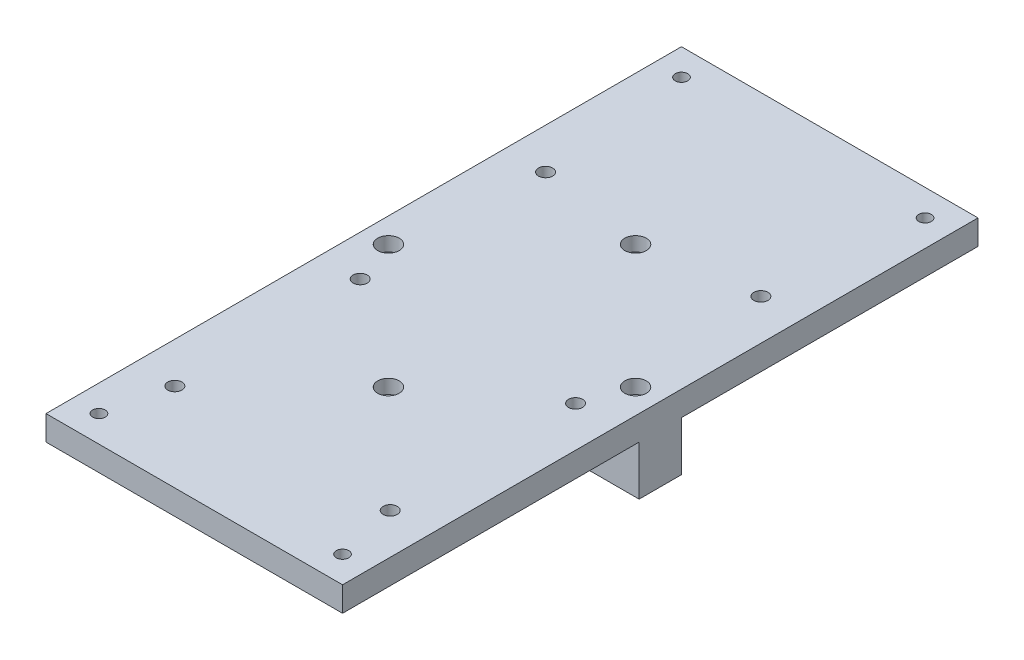
from build123d import *

# Parameters (mm, degrees)
SKETCH1_W           = 84
SKETCH1_H           = 180
BOSS_EXTRUDE1_DEPTH = 7
SKETCH2_R           = 1.775
CUT_EXTRUDE1_DEPTH  = 103.960355362
SKETCH3_R           = 3.05
CUT_EXTRUDE2_DEPTH  = 4
SKETCH5_W           = 12
SKETCH5_H           = 12
SKETCH5_W_2         = 14
BOSS_EXTRUDE2_DEPTH = 14
SKETCH6_R           = 1.775
CUT_EXTRUDE3_DEPTH  = 105.846720389
SKETCH7_R           = 2
CUT_EXTRUDE4_DEPTH  = 105.846720389
SKETCH8_R           = 1.775
CUT_EXTRUDE5_DEPTH  = 105.846720389


with BuildPart() as part:
    # Sketch1 → Boss-Extrude1 (new body)
    with BuildSketch(Plane(origin=(0, 0, 0), x_dir=(1, 0, 0), z_dir=(0, 1, 0))):
        with Locations((-5.498242658, 1.081017345)):
            Rectangle(SKETCH1_W, SKETCH1_H)
    extrude(amount=BOSS_EXTRUDE1_DEPTH)

    # Sketch2 → Cut-Extrude1 (cut, through all)
    with BuildSketch(Plane(origin=(0, 7, 0), x_dir=(1, 0, 0), z_dir=(0, 1, 0))):
        with Locations(Location((-40.498242658, 1.081017345, 0), (0, 0, 270))):
            Circle(SKETCH2_R)
        with Locations(Location((-5.498242658, -33.918982655, 0), (0, 0, 270))):
            Circle(SKETCH2_R)
        with Locations(Location((29.501757342, 1.081017345, 0), (0, 0, 270))):
            Circle(SKETCH2_R)
        with Locations(Location((-5.498242658, 36.081017345, 0), (0, 0, 270))):
            Circle(SKETCH2_R)
    extrude(amount=-CUT_EXTRUDE1_DEPTH, mode=Mode.SUBTRACT)

    # Sketch3 → Cut-Extrude2 (cut)
    with BuildSketch(Plane(origin=(0, 7, 0), x_dir=(1, 0, 0), z_dir=(0, 1, 0))):
        with Locations(Location((-40.498242658, 1.081017345, 0), (0, 0, 270))):
            Circle(SKETCH3_R)
        with Locations(Location((-5.498242658, -33.918982655, 0), (0, 0, 270))):
            Circle(SKETCH3_R)
        with Locations(Location((-5.498242658, 36.081017345, 0), (0, 0, 270))):
            Circle(SKETCH3_R)
        with Locations(Location((29.501757342, 1.081017345, 0), (0, 0, 270))):
            Circle(SKETCH3_R)
    extrude(amount=-CUT_EXTRUDE2_DEPTH, mode=Mode.SUBTRACT)

    # Sketch5 → Boss-Extrude2 (add)
    with BuildSketch(Plane(origin=(0, 0, 0), x_dir=(-1, 0, 0), z_dir=(0, -1, 0))):
        with Locations((5.498242658, -33.918982655)):
            Rectangle(SKETCH5_W, SKETCH5_H)
        with Locations((40.498242658, 1.081017345)):
            Rectangle(SKETCH5_W_2, SKETCH5_H)
        with Locations((5.498242658, 36.081017345)):
            Rectangle(SKETCH5_W, SKETCH5_H)
        with Locations((-29.501757342, 1.081017345)):
            Rectangle(SKETCH5_W_2, SKETCH5_H)
    extrude(amount=BOSS_EXTRUDE2_DEPTH)

    # Sketch6 → Cut-Extrude3 (cut, through all)
    with BuildSketch(Plane(origin=(0, 7, 0), x_dir=(1, 0, 0), z_dir=(0, 1, 0))):
        with Locations(Location((-40.498242658, 1.081017345, 0), (0, 0, 270))):
            Circle(SKETCH6_R)
        with Locations(Location((29.501757342, 1.081017345, 0), (0, 0, 270))):
            Circle(SKETCH6_R)
        with Locations(Location((-5.498242658, -33.918982655, 0), (0, 0, 270))):
            Circle(SKETCH6_R)
        with Locations(Location((-5.498242658, 36.081017345, 0), (0, 0, 270))):
            Circle(SKETCH6_R)
    extrude(amount=-CUT_EXTRUDE3_DEPTH, mode=Mode.SUBTRACT)

    # Sketch7 → Cut-Extrude4 (cut, through all)
    with BuildSketch(Plane(origin=(0, 7, 0), x_dir=(1, 0, 0), z_dir=(0, 1, 0))):
        with Locations(Location((-35.998242658, -63.918982655, 0), (0, 0, 270))):
            Circle(SKETCH7_R)
        with Locations(Location((-35.998242658, -11.418982655, 0), (0, 0, 270))):
            Circle(SKETCH7_R)
        with Locations(Location((-35.998242658, 41.081017345, 0), (0, 0, 270))):
            Circle(SKETCH7_R)
        with Locations(Location((25.001757342, -63.918982655, 0), (0, 0, 270))):
            Circle(SKETCH7_R)
        with Locations(Location((25.001757342, -11.418982655, 0), (0, 0, 270))):
            Circle(SKETCH7_R)
        with Locations(Location((25.001757342, 41.081017345, 0), (0, 0, 270))):
            Circle(SKETCH7_R)
    extrude(amount=-CUT_EXTRUDE4_DEPTH, mode=Mode.SUBTRACT)

    # Sketch8 → Cut-Extrude5 (cut, through all)
    with BuildSketch(Plane(origin=(0, 7, 0), x_dir=(1, 0, 0), z_dir=(0, 1, 0))):
        with Locations(Location((-39.998242658, -81.418982655, 0), (0, 0, 270))):
            Circle(SKETCH8_R)
        with Locations(Location((-39.998242658, 83.581017345, 0), (0, 0, 270))):
            Circle(SKETCH8_R)
        with Locations(Location((29.001757342, 83.581017345, 0), (0, 0, 270))):
            Circle(SKETCH8_R)
        with Locations(Location((29.001757342, -81.418982655, 0), (0, 0, 270))):
            Circle(SKETCH8_R)
    extrude(amount=-CUT_EXTRUDE5_DEPTH, mode=Mode.SUBTRACT)


solid = part.part
